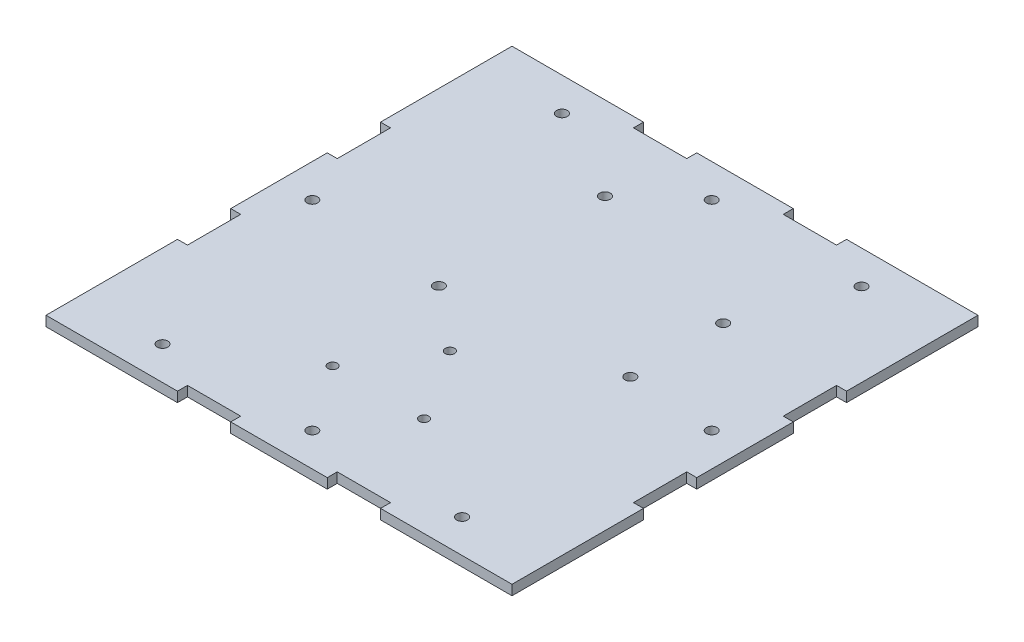
from build123d import *

# Parameters (mm, degrees)
SKETCH2_W           = 140
SKETCH2_H           = 140
SKETCH2_R           = 1.6
SKETCH2_R_2         = 1.4
BOSS_EXTRUDE2_DEPTH = 3
SKETCH3_W           = 16
SKETCH3_H           = 3
SKETCH3_W_2         = 3
SKETCH3_H_2         = 16
CUT_EXTRUDE2_DEPTH  = 3


with BuildPart() as part:
    # Sketch2 → Boss-Extrude2 (new body)
    with BuildSketch(Plane(origin=(0, 0, 0), x_dir=(1, 0, 0), z_dir=(0, 1, 0))):
        Rectangle(SKETCH2_W, SKETCH2_H)
        with Locations(Location((-17.011581703, 44.949159058, 0), (0, 0, 270))):
            Circle(SKETCH2_R, mode=Mode.SUBTRACT)
        with Locations(Location((-18.611581703, -3.350840942, 0), (0, 0, 270))):
            Circle(SKETCH2_R, mode=Mode.SUBTRACT)
        with Locations(Location((33.788418297, 29.649159058, 0), (0, 0, 270))):
            Circle(SKETCH2_R, mode=Mode.SUBTRACT)
        with Locations(Location((33.788418297, 1.749159058, 0), (0, 0, 270))):
            Circle(SKETCH2_R, mode=Mode.SUBTRACT)
        with Locations(Location((0, 60, 0), (0, 0, 270))):
            Circle(SKETCH2_R, mode=Mode.SUBTRACT)
        with Locations(Location((-60, 0, 0), (0, 0, 270))):
            Circle(SKETCH2_R, mode=Mode.SUBTRACT)
        with Locations(Location((0, -60, 0), (0, 0, 270))):
            Circle(SKETCH2_R, mode=Mode.SUBTRACT)
        with Locations(Location((60, 0, 0), (0, 0, 270))):
            Circle(SKETCH2_R, mode=Mode.SUBTRACT)
        with Locations(Location((-45, 60, 0), (0, 0, 270))):
            Circle(SKETCH2_R, mode=Mode.SUBTRACT)
        with Locations(Location((45, 60, 0), (0, 0, 270))):
            Circle(SKETCH2_R, mode=Mode.SUBTRACT)
        with Locations(Location((-45, -60, 0), (0, 0, 270))):
            Circle(SKETCH2_R, mode=Mode.SUBTRACT)
        with Locations(Location((45, -60, 0), (0, 0, 270))):
            Circle(SKETCH2_R, mode=Mode.SUBTRACT)
        with Locations(Location((-0.030225379, -18.62367845, 0), (0, 0, 270))):
            Circle(SKETCH2_R_2, mode=Mode.SUBTRACT)
        with Locations(Location((-13.780225379, -40.12367845, 0), (0, 0, 270))):
            Circle(SKETCH2_R_2, mode=Mode.SUBTRACT)
        with Locations(Location((13.719774621, -40.12367845, 0), (0, 0, 270))):
            Circle(SKETCH2_R_2, mode=Mode.SUBTRACT)
    extrude(amount=BOSS_EXTRUDE2_DEPTH)

    # Sketch3 → Cut-Extrude2 (cut)
    with BuildSketch(Plane(origin=(0, 3, 0), x_dir=(1, 0, 0), z_dir=(0, 1, 0))):
        with Locations((-22.5, 68.5)):
            Rectangle(SKETCH3_W, SKETCH3_H)
        with Locations((-22.5, -68.5)):
            Rectangle(SKETCH3_W, SKETCH3_H)
        with Locations((22.5, -68.5)):
            Rectangle(SKETCH3_W, SKETCH3_H)
        with Locations((22.5, 68.5)):
            Rectangle(SKETCH3_W, SKETCH3_H)
        with Locations((-68.5, 22.5)):
            Rectangle(SKETCH3_W_2, SKETCH3_H_2)
        with Locations((68.5, 22.5)):
            Rectangle(SKETCH3_W_2, SKETCH3_H_2)
        with Locations((68.5, -22.5)):
            Rectangle(SKETCH3_W_2, SKETCH3_H_2)
        with Locations((-68.5, -22.5)):
            Rectangle(SKETCH3_W_2, SKETCH3_H_2)
    extrude(amount=-CUT_EXTRUDE2_DEPTH, mode=Mode.SUBTRACT)


solid = part.part
